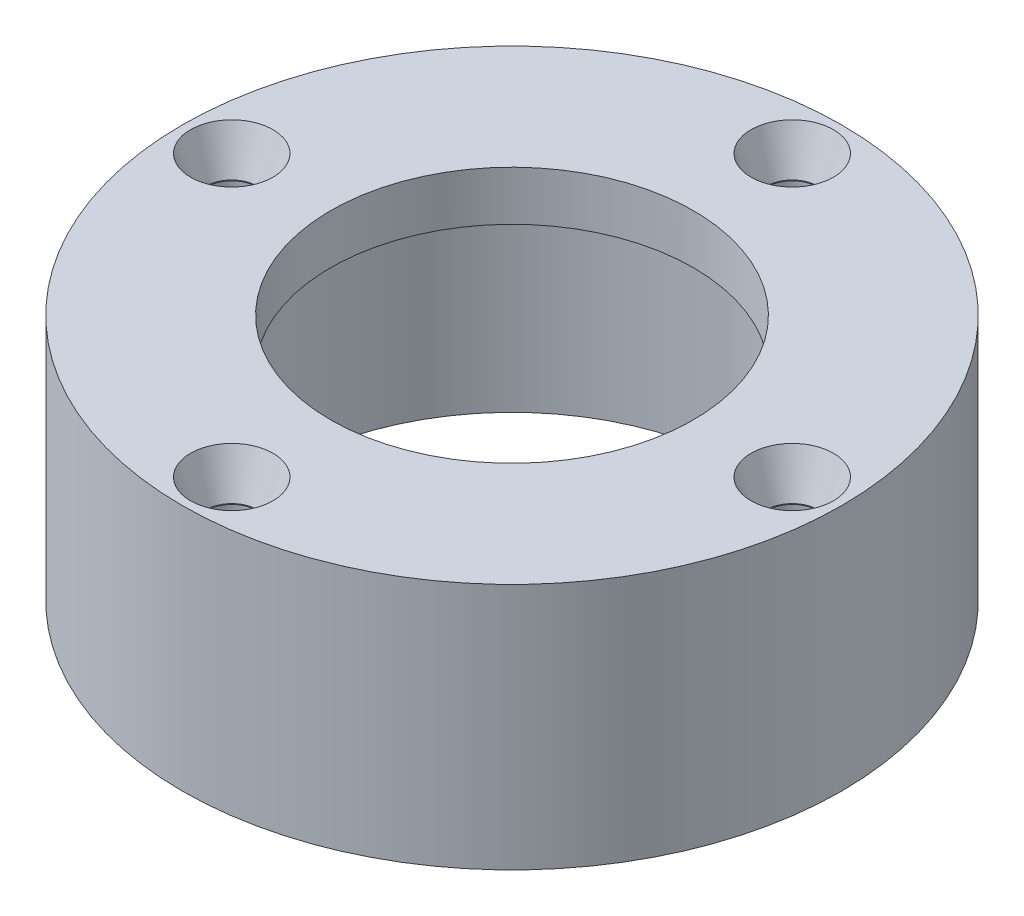
from build123d import *

# Parameters (mm, degrees)
SKETCH1_R                    = 20
BOSS_EXTRUDE1_DEPTH          = 15
SKETCH2_R                    = 1.5
CUT_EXTRUDE1_DEPTH           = 20
SKETCH3_R                    = 2.5
CUT_EXTRUDE2_DEPTH           = 2.5
CUT_EXTRUDE2_DRAFT           = -20.5
CUT_EXTRUDE2_PROFILE_2_DEPTH = 2.5
CUT_EXTRUDE2_PROFILE_2_DRAFT = -20.5
CUT_EXTRUDE2_PROFILE_3_DEPTH = 2.5
CUT_EXTRUDE2_PROFILE_3_DRAFT = -20.5
CUT_EXTRUDE2_PROFILE_4_DEPTH = 2.5
CUT_EXTRUDE2_PROFILE_4_DRAFT = -20.5
SKETCH4_R                    = 14
CUT_EXTRUDE3_DEPTH           = 12
SKETCH5_R                    = 11
CUT_EXTRUDE4_DEPTH           = 12


with BuildPart() as part:
    # Sketch1 → Boss-Extrude1 (new body)
    with BuildSketch(Plane(origin=(0, 0, 0), x_dir=(1, 0, 0), z_dir=(0, 1, 0))):
        with Locations(Location((0, 0, 0), (0, 0, 270))):
            Circle(SKETCH1_R)
    extrude(amount=BOSS_EXTRUDE1_DEPTH)

    # Sketch2 → Cut-Extrude1 (cut)
    with BuildSketch(Plane(origin=(0, 0, 0), x_dir=(-1, 0, 0), z_dir=(0, -1, 0))):
        with Locations(Location((0, -17, 0), (0, 0, 90))):
            Circle(SKETCH2_R)
        with Locations(Location((-17, 0, 0), (0, 0, 90))):
            Circle(SKETCH2_R)
        with Locations(Location((0, 17, 0), (0, 0, 90))):
            Circle(SKETCH2_R)
        with Locations(Location((17, 0, 0), (0, 0, 90))):
            Circle(SKETCH2_R)
    extrude(amount=-CUT_EXTRUDE1_DEPTH, mode=Mode.SUBTRACT)


with BuildPart() as cut_extrude2_tool:
    # Sketch3 → Cut-Extrude2 (with draft: the straight prism first)
    with BuildSketch(Plane(origin=(0, 15, 0), x_dir=(1, 0, 0), z_dir=(0, 1, 0))):
        with Locations((0, 17)):
            Circle(SKETCH3_R)
    extrude(amount=-CUT_EXTRUDE2_DEPTH)
    # Cut-Extrude2: the draft: its side faces are tilted about the plane it starts from
    cut_extrude2_sides = [cut_extrude2_tool.faces().sort_by_distance(p)[0] for p in [
        (-2.5, 13.75, -17),
    ]]
    draft(cut_extrude2_sides, Plane(origin=(0, 15, 0), x_dir=(1, 0, 0), z_dir=(0, 1, 0)), CUT_EXTRUDE2_DRAFT)


with BuildPart() as part_1:
    add(part.part)

    # Cut-Extrude2: cut by cut_extrude2_tool
    add(cut_extrude2_tool.part, mode=Mode.SUBTRACT)


with BuildPart() as cut_extrude2_profile_2_tool:
    # Sketch3 → Cut-Extrude2 profile 2 (with draft: the straight prism first)
    with BuildSketch(Plane(origin=(0, 15, 0), x_dir=(1, 0, 0), z_dir=(0, 1, 0))):
        with Locations((17, 0)):
            Circle(SKETCH3_R)
    extrude(amount=-CUT_EXTRUDE2_PROFILE_2_DEPTH)
    # Cut-Extrude2 profile 2: the draft: its side faces are tilted about the plane it starts from
    cut_extrude2_profile_2_sides = [cut_extrude2_profile_2_tool.faces().sort_by_distance(p)[0] for p in [
        (14.5, 13.75, 0),
    ]]
    draft(cut_extrude2_profile_2_sides, Plane(origin=(0, 15, 0), x_dir=(1, 0, 0), z_dir=(0, 1, 0)), CUT_EXTRUDE2_PROFILE_2_DRAFT)


with BuildPart() as part_2:
    add(part_1.part)

    # Cut-Extrude2 profile 2: cut by cut_extrude2_profile_2_tool
    add(cut_extrude2_profile_2_tool.part, mode=Mode.SUBTRACT)


with BuildPart() as cut_extrude2_profile_3_tool:
    # Sketch3 → Cut-Extrude2 profile 3 (with draft: the straight prism first)
    with BuildSketch(Plane(origin=(0, 15, 0), x_dir=(1, 0, 0), z_dir=(0, 1, 0))):
        with Locations((0, -17)):
            Circle(SKETCH3_R)
    extrude(amount=-CUT_EXTRUDE2_PROFILE_3_DEPTH)
    # Cut-Extrude2 profile 3: the draft: its side faces are tilted about the plane it starts from
    cut_extrude2_profile_3_sides = [cut_extrude2_profile_3_tool.faces().sort_by_distance(p)[0] for p in [
        (-2.5, 13.75, 17),
    ]]
    draft(cut_extrude2_profile_3_sides, Plane(origin=(0, 15, 0), x_dir=(1, 0, 0), z_dir=(0, 1, 0)), CUT_EXTRUDE2_PROFILE_3_DRAFT)


with BuildPart() as part_3:
    add(part_2.part)

    # Cut-Extrude2 profile 3: cut by cut_extrude2_profile_3_tool
    add(cut_extrude2_profile_3_tool.part, mode=Mode.SUBTRACT)


with BuildPart() as cut_extrude2_profile_4_tool:
    # Sketch3 → Cut-Extrude2 profile 4 (with draft: the straight prism first)
    with BuildSketch(Plane(origin=(0, 15, 0), x_dir=(1, 0, 0), z_dir=(0, 1, 0))):
        with Locations((-17, 0)):
            Circle(SKETCH3_R)
    extrude(amount=-CUT_EXTRUDE2_PROFILE_4_DEPTH)
    # Cut-Extrude2 profile 4: the draft: its side faces are tilted about the plane it starts from
    cut_extrude2_profile_4_sides = [cut_extrude2_profile_4_tool.faces().sort_by_distance(p)[0] for p in [
        (-19.5, 13.75, 0),
    ]]
    draft(cut_extrude2_profile_4_sides, Plane(origin=(0, 15, 0), x_dir=(1, 0, 0), z_dir=(0, 1, 0)), CUT_EXTRUDE2_PROFILE_4_DRAFT)


with BuildPart() as part_4:
    add(part_3.part)

    # Cut-Extrude2 profile 4: cut by cut_extrude2_profile_4_tool
    add(cut_extrude2_profile_4_tool.part, mode=Mode.SUBTRACT)

    # Sketch4 → Cut-Extrude3 (cut)
    with BuildSketch(Plane.XZ):
        with Locations(Location((0, 0, 0), (0, 0, 270))):
            Circle(SKETCH4_R)
    extrude(amount=-CUT_EXTRUDE3_DEPTH, mode=Mode.SUBTRACT)

    # Sketch5 → Cut-Extrude4 (cut)
    with BuildSketch(Plane(origin=(0, 15, 0), x_dir=(1, 0, 0), z_dir=(0, 1, 0))):
        with Locations(Location((0, 0, 0), (0, 0, 270))):
            Circle(SKETCH5_R)
    extrude(amount=-CUT_EXTRUDE4_DEPTH, mode=Mode.SUBTRACT)


solid = part_4.part
